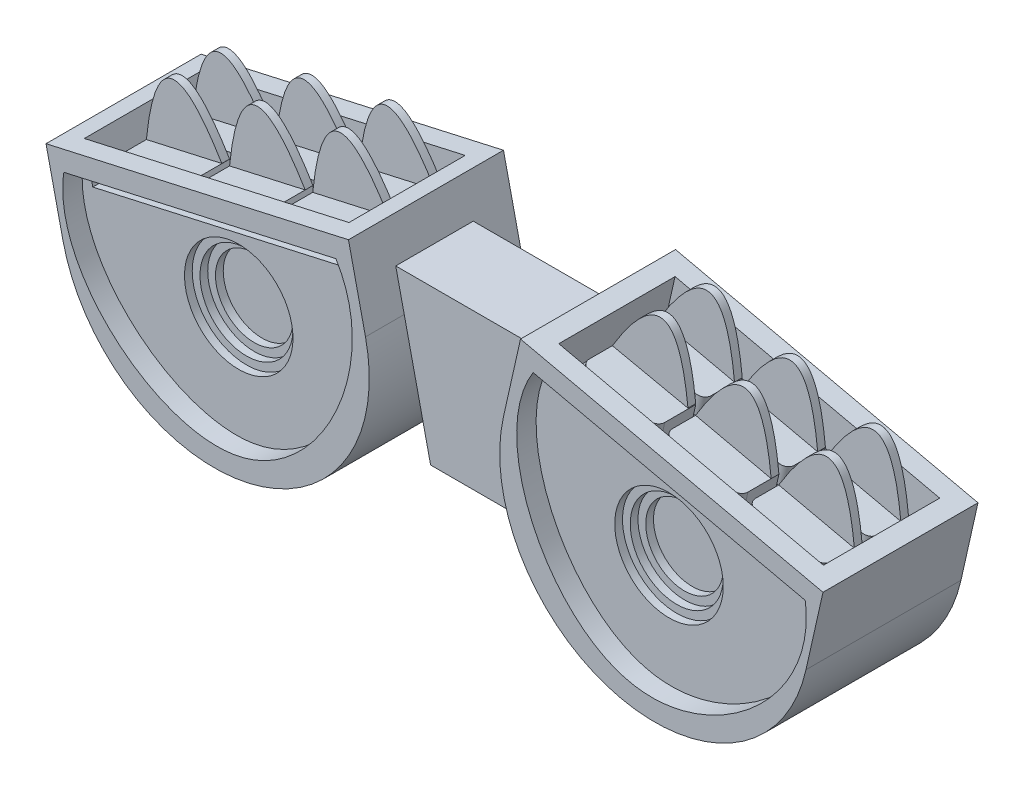
from build123d import *

# Parameters (mm, degrees)
SKETCH1_W            = 20
SKETCH1_H            = 10
BOSS_EXTRUDE1_DEPTH  = 20
CUT_EXTRUDE1_DEPTH   = 10
SKETCH6_W            = 20
SKETCH6_H            = 10
BOSS_EXTRUDE4_DEPTH  = 40
BOSS_EXTRUDE5_DEPTH  = 20
SKETCH17_R           = 2.5
CUT_EXTRUDE9_DEPTH   = 10
CUT_EXTRUDE10_DEPTH  = 2.5
SKETCH22_R           = 7
CUT_EXTRUDE11_DEPTH  = 1
SKETCH24_R           = 6
CUT_EXTRUDE12_DEPTH  = 1
SKETCH25_R           = 5
CUT_EXTRUDE13_DEPTH  = 1
SKETCH26_W           = 35
SKETCH26_H           = 15
CUT_EXTRUDE14_DEPTH  = 5
BOSS_EXTRUDE6_DEPTH  = 2.5
BOSS_EXTRUDE7_DEPTH  = 1
BOSS_EXTRUDE8_DEPTH  = 1
BOSS_EXTRUDE9_DEPTH  = 2.5
BOSS_EXTRUDE10_DEPTH = 1
BOSS_EXTRUDE11_DEPTH = 1


with BuildPart() as part:
    # Sketch1 → Boss-Extrude1 (new body)
    with BuildSketch(Plane(origin=(0, 0, 0), x_dir=(1, 0, 0), z_dir=(0, 1, 0))):
        with Locations((-7.153246753, -34.08961039)):
            Rectangle(SKETCH1_W, SKETCH1_H)
    extrude(amount=BOSS_EXTRUDE1_DEPTH)

    # Sketch2 → Cut-Extrude1 (cut)
    with BuildSketch(Plane.XY.offset(39.08961039)):
        Polygon((-17.153246753, 20), (-17.153246753, 0), (-12.653246753, 0), align=None)
        Polygon((2.846753247, 0), (2.846753247, 20), (-1.653246753, 0), align=None)
    extrude(amount=-CUT_EXTRUDE1_DEPTH, mode=Mode.SUBTRACT)

    # Sketch6 → Boss-Extrude4 (add)
    with BuildSketch(Plane(origin=(-1.57358406, 0.354056414, 0), x_dir=(0, 0, -1), z_dir=(0.975609756097561, -0.21951219512195122, 0))):
        with Locations((-34.08961039, 20.137092176)):
            Rectangle(SKETCH6_W, SKETCH6_H)
    boss_extrude4 = extrude(amount=BOSS_EXTRUDE4_DEPTH)

    # Sketch8 → Boss-Extrude5 (add)
    with BuildSketch(Plane.XY.offset(44.08961039)):
        with BuildLine():
            Line((1.749192271, 15.12195122), (40.773582515, 6.341463415))
            ThreePointArc((40.773582515, 6.341463415), (16.871143491, -8.780487805), (1.749192271, 15.12195122))
        make_face()
    boss_extrude5 = extrude(amount=-BOSS_EXTRUDE5_DEPTH)

    # Mirror2: Boss-Extrude4, Boss-Extrude5 across plane
    add(boss_extrude4.mirror(Plane(origin=(-7.153246753, 0, 0), x_dir=(0, 0, 1), z_dir=(1, 0, 0))))
    add(boss_extrude5.mirror(Plane(origin=(-7.153246753, 0, 0), x_dir=(0, 0, 1), z_dir=(1, 0, 0))))

    # Sketch17 → Cut-Extrude9 (cut)
    with BuildSketch(Plane.XZ):
        with Locations((-7.153246753, 34.08961039)):
            Circle(SKETCH17_R)
    extrude(amount=-CUT_EXTRUDE9_DEPTH, mode=Mode.SUBTRACT)

    # Sketch18 → Cut-Extrude10 (cut)
    with BuildSketch(Plane.XY.offset(44.08961039)):
        with BuildLine():
            Line((5.570269443, 21.949708856), (40.669995077, 14.052270588))
            add(Edge.make_bspline(
                [(40.669995077, 14.052270588), (42.333912326, 2.793072909), (14.944726605, -20.271381225), (-0.478983264, 12.274640553), (5.570269443, 21.949708856)],
                knots=[0, 0, 0, 0, 0.496132436, 1, 1, 1, 1], degree=3))
        make_face()
    cut_extrude10 = extrude(amount=-CUT_EXTRUDE10_DEPTH, mode=Mode.SUBTRACT)

    # Sketch22 → Cut-Extrude11 (cut)
    with BuildSketch(Plane.XY.offset(41.58961039)):
        with Locations((20.602850808, 7.804878049)):
            Circle(SKETCH22_R)
    cut_extrude11 = extrude(amount=-CUT_EXTRUDE11_DEPTH, mode=Mode.SUBTRACT)

    # Sketch24 → Cut-Extrude12 (cut)
    with BuildSketch(Plane.XY.offset(40.58961039)):
        with Locations((20.602850808, 7.804878049)):
            Circle(SKETCH24_R)
    cut_extrude12 = extrude(amount=-CUT_EXTRUDE12_DEPTH, mode=Mode.SUBTRACT)

    # Sketch25 → Cut-Extrude13 (cut)
    with BuildSketch(Plane.XY.offset(39.58961039)):
        with Locations((20.602850808, 7.804878049)):
            Circle(SKETCH25_R)
    cut_extrude13 = extrude(amount=-CUT_EXTRUDE13_DEPTH, mode=Mode.SUBTRACT)

    # Mirror3: Cut-Extrude10, Cut-Extrude11, Cut-Extrude12, Cut-Extrude13 across plane
    add(cut_extrude10.mirror(Plane(origin=(-7.153246753, 0, 0), x_dir=(0, 0, 1), z_dir=(1, 0, 0))), mode=Mode.SUBTRACT)
    add(cut_extrude11.mirror(Plane(origin=(-7.153246753, 0, 0), x_dir=(0, 0, 1), z_dir=(1, 0, 0))), mode=Mode.SUBTRACT)
    add(cut_extrude12.mirror(Plane(origin=(-7.153246753, 0, 0), x_dir=(0, 0, 1), z_dir=(1, 0, 0))), mode=Mode.SUBTRACT)
    add(cut_extrude13.mirror(Plane(origin=(-7.153246753, 0, 0), x_dir=(0, 0, 1), z_dir=(1, 0, 0))), mode=Mode.SUBTRACT)

    # Sketch26 → Cut-Extrude14 (cut)
    with BuildSketch(Plane(origin=(5.517898283, 24.523992367, 0), x_dir=(0.9756097560975611, -0.2195121951219514, 0), z_dir=(0.2195121951219514, 0.9756097560975611, 0))):
        with Locations((18.387076338, -34.08961039)):
            Rectangle(SKETCH26_W, SKETCH26_H)
    cut_extrude14 = extrude(amount=-CUT_EXTRUDE14_DEPTH, mode=Mode.SUBTRACT)

    # Sketch27 → Boss-Extrude6 (add)
    with BuildSketch(Plane(origin=(4.420337307, 19.645943586, 0), x_dir=(0.9756097560975611, -0.21951219512195141, 0), z_dir=(0.21951219512195141, 0.9756097560975611, 0))):
        with BuildLine():
            Line((2.387076338, -28.58961039), (12.387076338, -28.58961039))
            Line((12.387076338, -28.58961039), (12.387076338, -32.58961039))
            ThreePointArc((12.387076338, -32.58961039), (12.094183119, -33.296717171), (11.387076338, -33.58961039))
            Line((11.387076338, -33.58961039), (3.387076338, -33.58961039))
            ThreePointArc((3.387076338, -33.58961039), (2.679969557, -33.296717171), (2.387076338, -32.58961039))
            Line((2.387076338, -32.58961039), (2.387076338, -28.58961039))
        make_face()
        with BuildLine():
            Line((13.387076338, -28.58961039), (23.387076338, -28.58961039))
            Line((23.387076338, -28.58961039), (23.387076338, -32.58961039))
            ThreePointArc((23.387076338, -32.58961039), (23.094183119, -33.296717171), (22.387076338, -33.58961039))
            Line((22.387076338, -33.58961039), (14.387076338, -33.58961039))
            ThreePointArc((14.387076338, -33.58961039), (13.679969557, -33.296717171), (13.387076338, -32.58961039))
            Line((13.387076338, -32.58961039), (13.387076338, -28.58961039))
        make_face()
        with BuildLine():
            Line((24.387076338, -28.58961039), (34.387076338, -28.58961039))
            Line((34.387076338, -28.58961039), (34.387076338, -32.58961039))
            ThreePointArc((34.387076338, -32.58961039), (34.094183119, -33.296717171), (33.387076338, -33.58961039))
            Line((33.387076338, -33.58961039), (25.387076338, -33.58961039))
            ThreePointArc((25.387076338, -33.58961039), (24.679969557, -33.296717171), (24.387076338, -32.58961039))
            Line((24.387076338, -32.58961039), (24.387076338, -28.58961039))
        make_face()
        with BuildLine():
            Line((2.387076338, -34.58961039), (12.387076338, -34.58961039))
            Line((12.387076338, -34.58961039), (12.387076338, -38.58961039))
            ThreePointArc((12.387076338, -38.58961039), (12.094183119, -39.296717171), (11.387076338, -39.58961039))
            Line((11.387076338, -39.58961039), (3.387076338, -39.58961039))
            ThreePointArc((3.387076338, -39.58961039), (2.679969557, -39.296717171), (2.387076338, -38.58961039))
            Line((2.387076338, -38.58961039), (2.387076338, -34.58961039))
        make_face()
        with BuildLine():
            Line((13.387076338, -34.58961039), (23.387076338, -34.58961039))
            Line((23.387076338, -34.58961039), (23.387076338, -38.58961039))
            ThreePointArc((23.387076338, -38.58961039), (23.094183119, -39.296717171), (22.387076338, -39.58961039))
            Line((22.387076338, -39.58961039), (14.387076338, -39.58961039))
            ThreePointArc((14.387076338, -39.58961039), (13.679969557, -39.296717171), (13.387076338, -38.58961039))
            Line((13.387076338, -38.58961039), (13.387076338, -34.58961039))
        make_face()
        with BuildLine():
            Line((24.387076338, -34.58961039), (34.387076338, -34.58961039))
            Line((34.387076338, -34.58961039), (34.387076338, -38.58961039))
            ThreePointArc((34.387076338, -38.58961039), (34.094183119, -39.296717171), (33.387076338, -39.58961039))
            Line((33.387076338, -39.58961039), (25.387076338, -39.58961039))
            ThreePointArc((25.387076338, -39.58961039), (24.679969557, -39.296717171), (24.387076338, -38.58961039))
            Line((24.387076338, -38.58961039), (24.387076338, -34.58961039))
        make_face()
    extrude(amount=BOSS_EXTRUDE6_DEPTH)

    # Sketch28 → Boss-Extrude7 (add)
    with BuildSketch(Plane(origin=(0, 0, 28.58961039), x_dir=(-1, 0, 0), z_dir=(0, 0, -1))):
        with BuildLine():
            Line((-7.297972759, 21.56097561), (-17.05407032, 19.365853659))
            add(Edge.make_bspline(
                [(-7.297972759, 21.56097561), (-15.468704466, 35.097560976), (-17.05407032, 19.365853659)],
                knots=[0, 0, 0, 1, 1, 1], degree=2))
        make_face()
        with BuildLine():
            Line((-18.029680076, 19.146341463), (-27.785777637, 16.951219512))
            add(Edge.make_bspline(
                [(-18.029680076, 19.146341463), (-26.200411783, 32.682926829), (-27.785777637, 16.951219512)],
                knots=[0, 0, 0, 1, 1, 1], degree=2))
        make_face()
        with BuildLine():
            Line((-28.761387393, 16.731707317), (-38.517484954, 14.536585366))
            add(Edge.make_bspline(
                [(-38.517484954, 14.536585366), (-36.9321191, 30.268292683), (-28.761387393, 16.731707317)],
                knots=[0, 0, 0, 1, 1, 1], degree=2))
        make_face()
    extrude(amount=-BOSS_EXTRUDE7_DEPTH)

    # Sketch29 → Boss-Extrude8 (add)
    with BuildSketch(Plane(origin=(0, 0, 34.58961039), x_dir=(-1, 0, 0), z_dir=(0, 0, -1))):
        with BuildLine():
            Line((-7.297972759, 21.56097561), (-17.049091928, 19.462522314))
            add(Edge.make_bspline(
                [(-7.297972759, 21.56097561), (-15.421274332, 35.060370323), (-17.049091928, 19.462522314)],
                knots=[0, 0, 0, 1, 1, 1], degree=2))
        make_face()
        with BuildLine():
            Line((-18.029680076, 19.146341463), (-27.785777637, 16.951219512))
            add(Edge.make_bspline(
                [(-18.029680076, 19.146341463), (-26.200411783, 32.682926829), (-27.785777637, 16.951219512)],
                knots=[0, 0, 0, 1, 1, 1], degree=2))
        make_face()
        with BuildLine():
            Line((-28.761387393, 16.731707317), (-38.517484954, 14.536585366))
            add(Edge.make_bspline(
                [(-28.761387393, 16.731707317), (-36.9321191, 30.268292683), (-38.517484954, 14.536585366)],
                knots=[0, 0, 0, 1, 1, 1], degree=2))
        make_face()
    extrude(amount=-BOSS_EXTRUDE8_DEPTH)


with BuildPart() as boss_extrude8_piece_1:
    # of the separate pieces the step leaves, piece 1, a body of its own (boss_extrude8_pieces)
    add(part.part.solids().sort_by_distance((-12.653246753, 0, 29.08961039))[0])

    # Mirror7: Cut-Extrude14 across plane
    add(cut_extrude14.mirror(Plane(origin=(-7.153246753, 0, 0), x_dir=(0, 0, 1), z_dir=(1, 0, 0))), mode=Mode.SUBTRACT)

    # Sketch30 → Boss-Extrude9 (add)
    with BuildSketch(Plane(origin=(-5.109704335, 22.709797044, 0), x_dir=(0.9756097560975611, 0.21951219512195141, 0), z_dir=(-0.21951219512195141, 0.9756097560975611, 0))):
        with BuildLine():
            Line((-48.344630979, -28.58961039), (-38.344630979, -28.58961039))
            Line((-38.344630979, -28.58961039), (-38.344630979, -32.58961039))
            ThreePointArc((-38.344630979, -32.58961039), (-38.637524198, -33.296717171), (-39.344630979, -33.58961039))
            Line((-39.344630979, -33.58961039), (-47.344630979, -33.58961039))
            ThreePointArc((-47.344630979, -33.58961039), (-48.05173776, -33.296717171), (-48.344630979, -32.58961039))
            Line((-48.344630979, -32.58961039), (-48.344630979, -28.58961039))
        make_face()
        with BuildLine():
            Line((-37.344630979, -28.58961039), (-27.344630979, -28.58961039))
            Line((-27.344630979, -28.58961039), (-27.344630979, -32.802908244))
            ThreePointArc((-27.344630979, -32.802908244), (-27.637524198, -33.510015025), (-28.344630979, -33.802908244))
            Line((-28.344630979, -33.802908244), (-36.344630979, -33.802908244))
            ThreePointArc((-36.344630979, -33.802908244), (-37.05173776, -33.510015025), (-37.344630979, -32.802908244))
            Line((-37.344630979, -32.802908244), (-37.344630979, -28.58961039))
        make_face()
        with BuildLine():
            Line((-26.344630979, -28.58961039), (-16.344630979, -28.58961039))
            Line((-16.344630979, -28.58961039), (-16.344630979, -32.802908244))
            ThreePointArc((-16.344630979, -32.802908244), (-16.637524198, -33.510015025), (-17.344630979, -33.802908244))
            Line((-17.344630979, -33.802908244), (-25.344630979, -33.802908244))
            ThreePointArc((-25.344630979, -33.802908244), (-26.05173776, -33.510015025), (-26.344630979, -32.802908244))
            Line((-26.344630979, -32.802908244), (-26.344630979, -28.58961039))
        make_face()
        with BuildLine():
            Line((-48.344630979, -34.58961039), (-38.344630979, -34.58961039))
            Line((-38.344630979, -34.58961039), (-38.344630979, -38.58961039))
            ThreePointArc((-38.344630979, -38.58961039), (-38.637524198, -39.296717171), (-39.344630979, -39.58961039))
            Line((-39.344630979, -39.58961039), (-47.344630979, -39.58961039))
            ThreePointArc((-47.344630979, -39.58961039), (-48.05173776, -39.296717171), (-48.344630979, -38.58961039))
            Line((-48.344630979, -38.58961039), (-48.344630979, -34.58961039))
        make_face()
        with BuildLine():
            Line((-37.344630979, -34.58961039), (-27.344630979, -34.58961039))
            Line((-27.344630979, -34.58961039), (-27.344630979, -38.681102219))
            ThreePointArc((-27.344630979, -38.681102219), (-27.637524198, -39.388209), (-28.344630979, -39.681102219))
            Line((-28.344630979, -39.681102219), (-36.344630979, -39.681102219))
            ThreePointArc((-36.344630979, -39.681102219), (-37.05173776, -39.388209), (-37.344630979, -38.681102219))
            Line((-37.344630979, -38.681102219), (-37.344630979, -34.58961039))
        make_face()
        with BuildLine():
            Line((-26.344630979, -34.58961039), (-16.344630979, -34.58961039))
            Line((-16.344630979, -34.58961039), (-16.344630979, -38.681102219))
            ThreePointArc((-16.344630979, -38.681102219), (-16.637524198, -39.388209), (-17.344630979, -39.681102219))
            Line((-17.344630979, -39.681102219), (-25.344630979, -39.681102219))
            ThreePointArc((-25.344630979, -39.681102219), (-26.05173776, -39.388209), (-26.344630979, -38.681102219))
            Line((-26.344630979, -38.681102219), (-26.344630979, -34.58961039))
        make_face()
    extrude(amount=BOSS_EXTRUDE9_DEPTH)

    # Sketch31 → Boss-Extrude10 (add)
    with BuildSketch(Plane(origin=(0, 0, 28.58961039), x_dir=(-1, 0, 0), z_dir=(0, 0, -1))):
        with BuildLine():
            Line((52.823978461, 14.536585366), (43.0678809, 16.731707317))
            add(Edge.make_bspline(
                [(52.823978461, 14.536585366), (51.238612607, 30.268292683), (43.0678809, 16.731707317)],
                knots=[0, 0, 0, 1, 1, 1], degree=2))
        make_face()
        with BuildLine():
            Line((42.092271143, 16.951219512), (32.336173583, 19.146341463))
            add(Edge.make_bspline(
                [(42.092271143, 16.951219512), (40.50690529, 32.682926829), (32.336173583, 19.146341463)],
                knots=[0, 0, 0, 1, 1, 1], degree=2))
        make_face()
        with BuildLine():
            Line((31.360563826, 19.365853659), (21.604466265, 21.56097561))
            add(Edge.make_bspline(
                [(31.360563826, 19.365853659), (29.775197973, 35.097560976), (21.604466265, 21.56097561)],
                knots=[0, 0, 0, 1, 1, 1], degree=2))
        make_face()
    extrude(amount=-BOSS_EXTRUDE10_DEPTH)

    # Sketch32 → Boss-Extrude11 (add)
    with BuildSketch(Plane(origin=(0, 0, 34.58961039), x_dir=(-1, 0, 0), z_dir=(0, 0, -1))):
        with BuildLine():
            Line((43.093309794, 16.725985816), (52.823978461, 14.536585366))
            add(Edge.make_bspline(
                [(52.823978461, 14.536585366), (51.23369628, 30.269408726), (43.093309794, 16.725985816)],
                knots=[0, 0, 0, 1, 1, 1], degree=2))
        make_face()
        with BuildLine():
            Line((32.336173583, 19.146341463), (42.092271143, 16.951219512))
            add(Edge.make_bspline(
                [(42.092271143, 16.951219512), (40.50690529, 32.682926829), (32.336173583, 19.146341463)],
                knots=[0, 0, 0, 1, 1, 1], degree=2))
        make_face()
        with BuildLine():
            Line((21.604466265, 21.56097561), (31.360563826, 19.365853659))
            add(Edge.make_bspline(
                [(21.604466265, 21.56097561), (29.775197973, 35.097560976), (31.360563826, 19.365853659)],
                knots=[0, 0, 0, 1, 1, 1], degree=2))
        make_face()
    extrude(amount=-BOSS_EXTRUDE11_DEPTH)


with BuildPart() as boss_extrude8_piece_2:
    # of the separate pieces the step leaves, piece 2, a body of its own (boss_extrude8_pieces)
    add(part.part.solids().sort_by_distance((17.049091928, 19.462522314, 34.58961039))[0])


solid = Compound([boss_extrude8_piece_1.part, boss_extrude8_piece_2.part])
